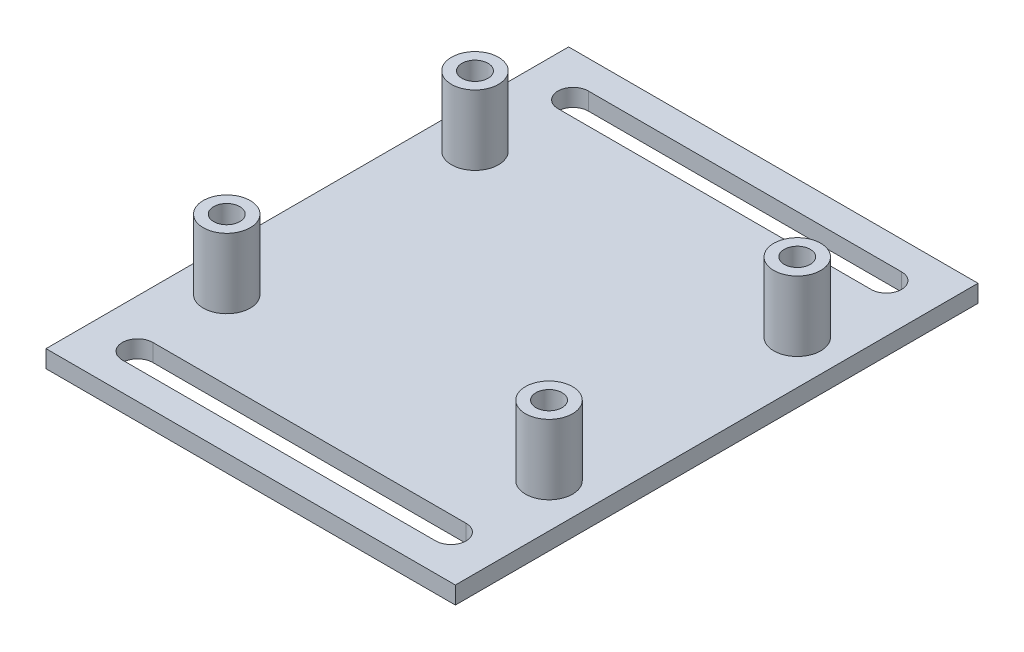
from build123d import *

# Parameters (mm, degrees)
SKETCH1_W           = 47
SKETCH1_H           = 60
BOSS_EXTRUDE1_DEPTH = 2
SKETCH2_R           = 2.7
SKETCH2_R_2         = 1.5
BOSS_EXTRUDE2_DEPTH = 8


with BuildPart() as part:
    # Sketch1 → Boss-Extrude1 (new body)
    with BuildSketch(Plane(origin=(0, 0, 0), x_dir=(1, 0, 0), z_dir=(0, 1, 0))):
        Rectangle(SKETCH1_W, SKETCH1_H)
        with BuildLine():
            Line((-17.98240987, 26.75), (17.98240987, 26.75))
            ThreePointArc((17.98240987, 26.75), (19.73240987, 25), (17.98240987, 23.25))
            Line((17.98240987, 23.25), (-17.98240987, 23.25))
            ThreePointArc((-17.98240987, 23.25), (-19.73240987, 25), (-17.98240987, 26.75))
        make_face(mode=Mode.SUBTRACT)
        with BuildLine():
            Line((-17.98240987, -23.25), (17.98240987, -23.25))
            ThreePointArc((17.98240987, -23.25), (19.73240987, -25), (17.98240987, -26.75))
            Line((17.98240987, -26.75), (-17.98240987, -26.75))
            ThreePointArc((-17.98240987, -26.75), (-19.73240987, -25), (-17.98240987, -23.25))
        make_face(mode=Mode.SUBTRACT)
    extrude(amount=BOSS_EXTRUDE1_DEPTH)

    # Sketch2 → Boss-Extrude2 (add)
    # profile 1 of 4: a face of its own
    with BuildSketch(Plane(origin=(0, 2, 0), x_dir=(1, 0, 0), z_dir=(0, 1, 0))):
        with Locations(Location((-18.5, 14.25, 0), (0, 0, 270))):
            Circle(SKETCH2_R)
        with Locations(Location((-18.5, 14.25, 0), (0, 0, 270))):
            Circle(SKETCH2_R_2, mode=Mode.SUBTRACT)
    # profile 2 of 4: a face of its own
    with BuildSketch(Plane(origin=(0, 2, 0), x_dir=(1, 0, 0), z_dir=(0, 1, 0))):
        with Locations(Location((18.5, 14.25, 0), (0, 0, 270))):
            Circle(SKETCH2_R)
        with Locations(Location((18.5, 14.25, 0), (0, 0, 270))):
            Circle(SKETCH2_R_2, mode=Mode.SUBTRACT)
    # profile 3 of 4: a face of its own
    with BuildSketch(Plane(origin=(0, 2, 0), x_dir=(1, 0, 0), z_dir=(0, 1, 0))):
        with Locations(Location((18.5, -14.25, 0), (0, 0, 270))):
            Circle(SKETCH2_R)
        with Locations(Location((18.5, -14.25, 0), (0, 0, 270))):
            Circle(SKETCH2_R_2, mode=Mode.SUBTRACT)
    # profile 4 of 4: a face of its own
    with BuildSketch(Plane(origin=(0, 2, 0), x_dir=(1, 0, 0), z_dir=(0, 1, 0))):
        with Locations(Location((-18.5, -14.25, 0), (0, 0, 270))):
            Circle(SKETCH2_R)
        with Locations(Location((-18.5, -14.25, 0), (0, 0, 270))):
            Circle(SKETCH2_R_2, mode=Mode.SUBTRACT)
    extrude(amount=BOSS_EXTRUDE2_DEPTH)


solid = part.part
